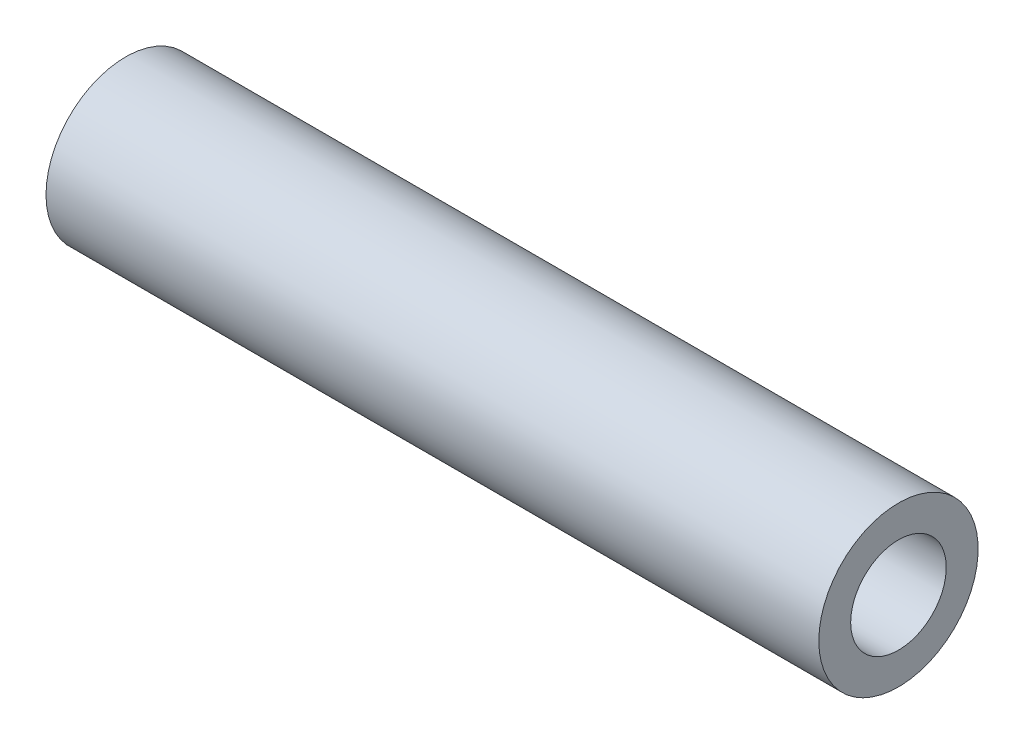
from build123d import *

# Parameters (mm, degrees)
SKETCH2_R           = 2.5
SKETCH2_R_2         = 1.5
BOSS_EXTRUDE1_DEPTH = 24.25


with BuildPart() as part:
    # Sketch2 → Boss-Extrude1 (new body)
    with BuildSketch(Plane.ZY.offset(-8.6)):
        with Locations((15.581935778, 50.792610241)):
            Circle(SKETCH2_R)
        with Locations(Location((15.581935778, 50.792610241, 0), (0, 0, 127.237693231))):
            Circle(SKETCH2_R_2, mode=Mode.SUBTRACT)
    extrude(amount=BOSS_EXTRUDE1_DEPTH)


solid = part.part
